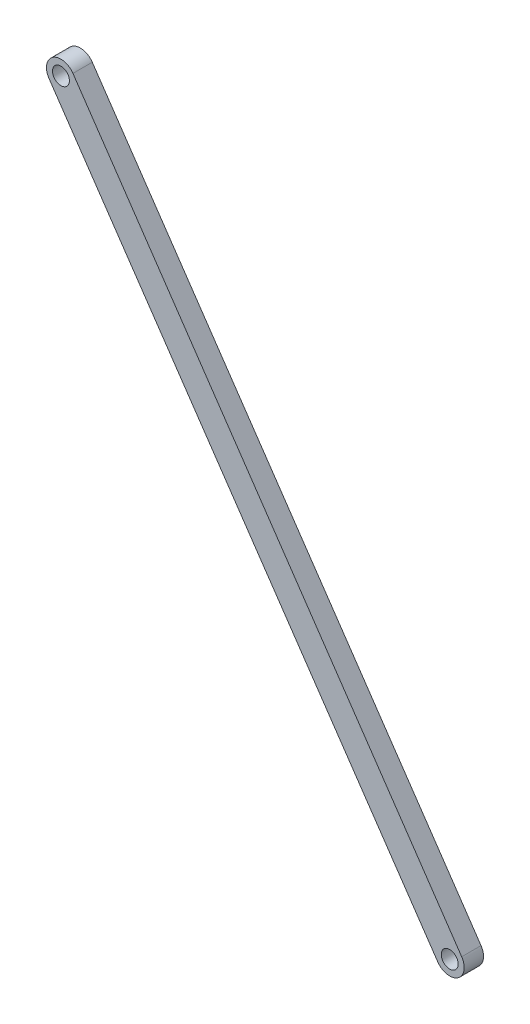
from build123d import *

# Parameters (mm, degrees)
SKETCH1_R           = 1.75
SKETCH1_R_2         = 1.6
BOSS_EXTRUDE1_DEPTH = 4
SKETCH2_R           = 1.750000006
CUT_EXTRUDE1_DEPTH  = 273.455015697


with BuildPart() as part:
    # Sketch1 → Boss-Extrude1 (new body)
    with BuildSketch(Plane(origin=(32.906081825, 0, 0), x_dir=(1, 0, 0), z_dir=(0, 0, 1))):
        with BuildLine():
            Line((20.329661808, -264.294564045), (-60.05514496, -146.294564045))
            ThreePointArc((-60.05514496, -146.294564045), (-59.264791143, -142.12619016), (-55.096417258, -142.916543976))
            Line((-55.096417258, -142.916543976), (25.288389509, -260.916543976))
            ThreePointArc((25.288389509, -260.916543976), (24.498035692, -265.084917861), (20.329661808, -264.294564045))
        make_face()
        with Locations((22.809025658, -262.60555401)):
            Circle(SKETCH1_R, mode=Mode.SUBTRACT)
        with Locations((-57.575781109, -144.60555401)):
            Circle(SKETCH1_R_2, mode=Mode.SUBTRACT)
    extrude(amount=BOSS_EXTRUDE1_DEPTH)

    # Sketch2 → Cut-Extrude1 (cut, through all)
    with BuildSketch(Plane(origin=(32.906081825, 0, 0), x_dir=(-1, 0, 0), z_dir=(0, 0, -1))):
        with Locations((57.575781109, -144.60555401)):
            Circle(SKETCH2_R)
    extrude(amount=-CUT_EXTRUDE1_DEPTH, mode=Mode.SUBTRACT)


solid = part.part
